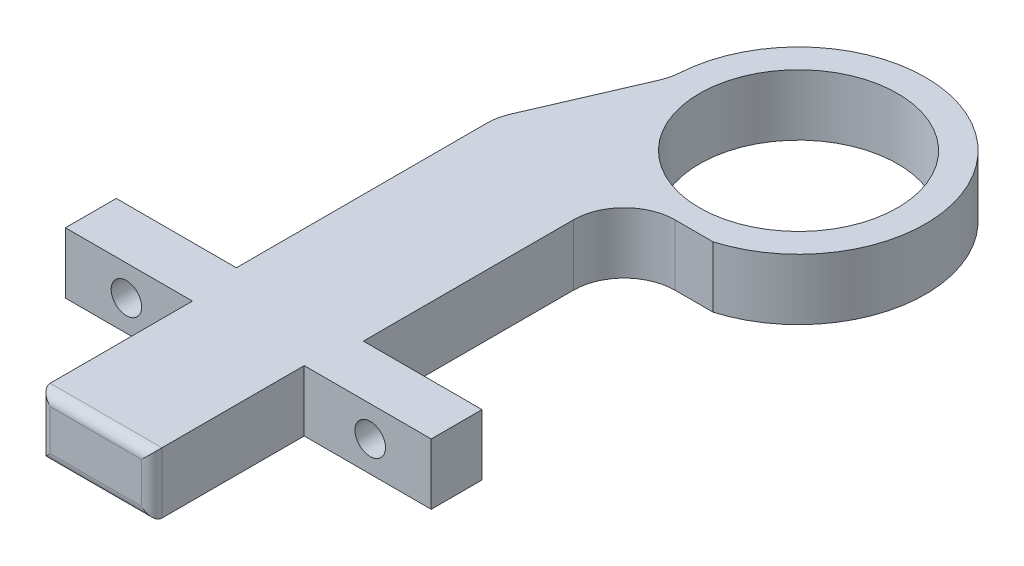
from build123d import *

# Parameters (mm, degrees)
CROQUIS1_R              = 9.75
SALIENTE_EXTRUIR1_DEPTH = 6
CROQUIS2_R              = 1.5
CORTAR_EXTRUIR1_DEPTH   = 6
REDONDEO1_R             = 1


with BuildPart() as part:
    # Croquis1 → Saliente-Extruir1 (new body)
    with BuildSketch(Plane(origin=(0, 0, 0), x_dir=(1, 0, 0), z_dir=(0, 1, 0))):
        with BuildLine():
            Line((-25.374701647, 20.783734094), (-29.767291136, 10.621141392))
            ThreePointArc((-29.767291136, 10.621141392), (-29.942112128, 10.153967486), (-30.069514751, 9.671699501))
            ThreePointArc((-30.069514751, 9.671699501), (-30.150557328, 9.157351254), (-30.17766953, 8.637363805))
            Line((-30.17766953, 8.637363805), (-30.17766953, -16))
            Line((-30.17766953, -16), (-42, -16))
            Line((-42, -16), (-42, -21))
            Line((-42, -21), (-29.5, -21))
            Line((-29.5, -21), (-29.5, -36))
            Line((-29.5, -36), (-18.5, -36))
            Line((-18.5, -36), (-18.5, -21))
            Line((-18.5, -21), (-6, -21))
            Line((-6, -21), (-6, -16))
            Line((-6, -16), (-17.67766953, -16))
            Line((-17.67766953, -16), (-17.67766953, 4.671699501))
            ThreePointArc((-17.67766953, 4.671699501), (-16.213203436, 8.207233407), (-12.67766953, 9.671699501))
            Line((-12.67766953, 9.671699501), (-8.928571429, 9.671699501))
            ThreePointArc((-8.928571429, 9.671699501), (-4.713647249, 31.429321655), (-24.974516609, 22.448404084))
            ThreePointArc((-24.974516609, 22.448404084), (-25.102827296, 21.598812807), (-25.374701647, 20.783734094))
        make_face()
        with Locations(Location((-12.5, 21.650635095, 0), (0, 0, 270))):
            Circle(CROQUIS1_R, mode=Mode.SUBTRACT)
    extrude(amount=SALIENTE_EXTRUIR1_DEPTH)

    # Croquis2 → Cortar-Extruir1 (cut)
    with BuildSketch(Plane.XY.offset(21)):
        with Locations((-36, 3)):
            Circle(CROQUIS2_R)
        with Locations((-12, 3)):
            Circle(CROQUIS2_R)
    extrude(amount=-CORTAR_EXTRUIR1_DEPTH, mode=Mode.SUBTRACT)

    # Redondeo1
    redondeo1_edges = [part.edges().sort_by_distance(p)[0] for p in [
        (-24, 0, 36),
        (-18.5, 3, 36),
        (-29.5, 3, 36),
        (-24, 6, 36),
    ]]
    fillet(redondeo1_edges, radius=REDONDEO1_R)


solid = part.part
